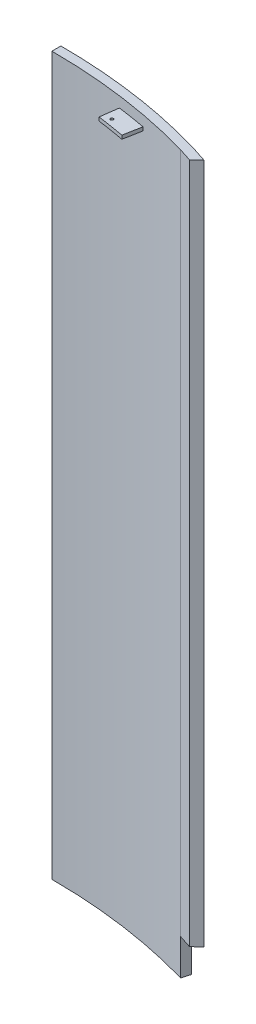
from build123d import *

# Parameters (mm, degrees)
EXTRUDE_1_DEPTH     = 2000
EXTRUDE_2_DEPTH     = 1900
EXTRUDE_START       = -10
EXTRUDE_3_DEPTH     = 10
SKETCH_4_R          = 4
CUT_EXTRUDE_1_DEPTH = 10


with BuildPart() as part:
    # 草图1 → 凸台-拉伸1 (new body)
    with BuildSketch(Plane(origin=(0, 0, 0), x_dir=(1, 0, 0), z_dir=(0, 1, 0))):
        with BuildLine():
            Line((0, 1540), (0, 1515))
            ThreePointArc((0, 1515), (210.847247954, 1500.256124143), (417.590594063, 1456.311469347))
            Line((417.590594063, 1456.311469347), (424.481527958, 1480.343011745))
            ThreePointArc((424.481527958, 1480.343011745), (214.326575478, 1525.012825862), (0, 1540))
        make_face()
    extrude(amount=EXTRUDE_1_DEPTH)

    # 草图2 → 凸台-拉伸2 (add)
    with BuildSketch(Plane(origin=(0, 2000, 0), x_dir=(1, 0, 0), z_dir=(0, 1, 0))):
        Polygon((475.59627434, 1463.734823878), (424.481527958, 1480.343011745), (417.590594063, 1456.311469347), (454.15659952, 1444.430453961), align=None)
    extrude(amount=-EXTRUDE_2_DEPTH)

    # 草图3 → 凸台-拉伸3 (add)
    with BuildSketch(Plane(origin=(0, 1970.4, 0), x_dir=(1, 0, 0), z_dir=(0, 1, 0)).offset(EXTRUDE_START)):
        with BuildLine():
            Line((201.678827868, 1501.516117259), (194.962988272, 1451.516117259))
            ThreePointArc((194.962988272, 1451.516117259), (232.892441695, 1445.915182873), (270.662282272, 1439.323290444))
            Line((270.662282272, 1439.323290444), (279.985715854, 1488.903287295))
            ThreePointArc((279.985715854, 1488.903287295), (240.914827355, 1495.722248935), (201.678827868, 1501.516117259))
        make_face()
    extrude(amount=EXTRUDE_3_DEPTH)

    # 草图4 → 切除-拉伸1 (cut)
    with BuildSketch(Plane(origin=(0, 1970.4, 0), x_dir=(1, 0, 0), z_dir=(0, 1, 0))):
        with Locations(Location((217.889718701, 1464.147071856, 0), (0, 0, 270))):
            Circle(SKETCH_4_R)
    extrude(amount=-CUT_EXTRUDE_1_DEPTH, mode=Mode.SUBTRACT)


solid = part.part
